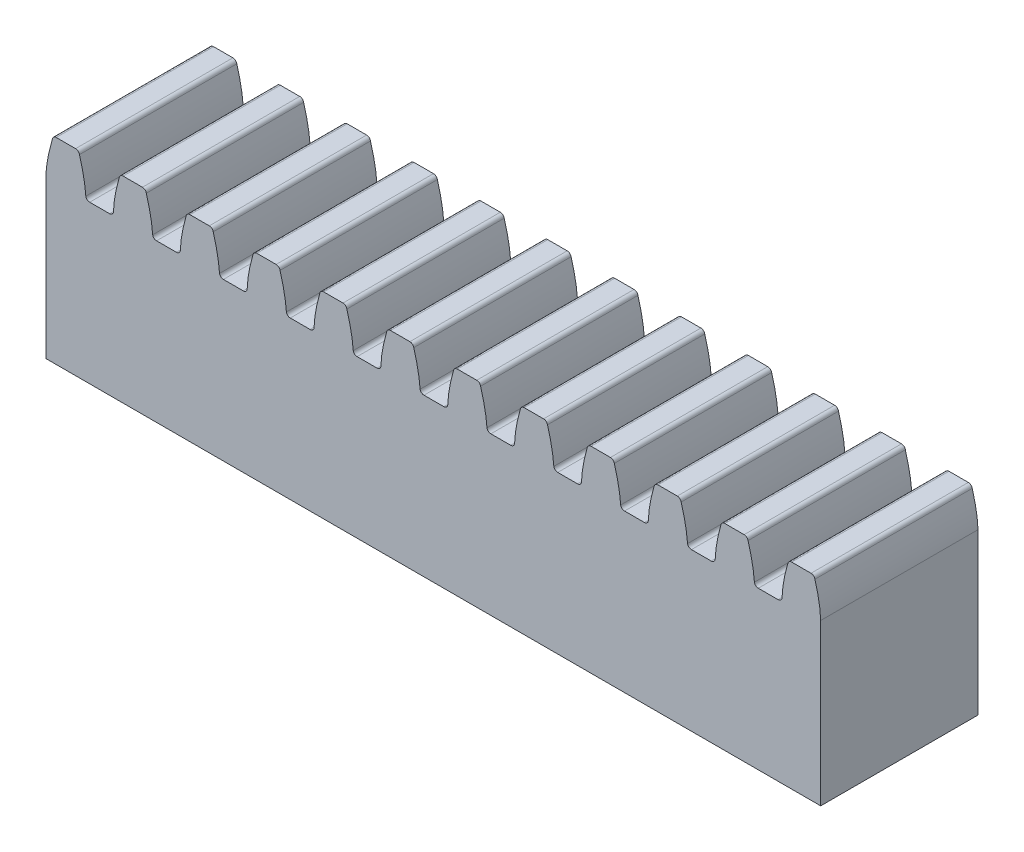
from build123d import *

# Parameters (mm, degrees)
BOSS_EXTRUDE1_DEPTH = 20


with BuildPart() as part:
    # Sketch2 → Boss-Extrude1 (new body)
    with BuildSketch(Plane.XY):
        with BuildLine():
            Line((5.555673684, 0), (8.080450184, 0))
            ThreePointArc((8.080450184, 0), (8.401843989, 0.116977778), (8.572854061, 0.413175911))
            add(Edge.make_bspline(
                [(9.308780843, 4.586824089), (8.63696399, 2.286518146), (8.572854061, 0.413175911)],
                knots=[0, 0, 0, 1, 1, 1], degree=2))
            ThreePointArc((9.308780843, 4.586824089), (9.479790914, 4.883022222), (9.801184719, 5))
            Line((9.801184719, 5), (12.262085088, 5))
            ThreePointArc((12.262085088, 5), (12.583478893, 4.883022222), (12.754488964, 4.586824089))
            add(Edge.make_bspline(
                [(12.754488964, 4.586824089), (13.426305818, 2.286518146), (13.563269807, 0.413175911)],
                knots=[0, 0, 0, 1, 1, 1], degree=2))
            ThreePointArc((13.563269807, 0.413175911), (13.734279879, 0.116977778), (14.055673684, 0))
            Line((14.055673684, 0), (16.580450184, 0))
            ThreePointArc((16.580450184, 0), (16.901843989, 0.116977778), (17.072854061, 0.413175911))
            add(Edge.make_bspline(
                [(17.808780843, 4.586824089), (17.13696399, 2.286518146), (17.072854061, 0.413175911)],
                knots=[0, 0, 0, 1, 1, 1], degree=2))
            ThreePointArc((17.808780843, 4.586824089), (17.979790914, 4.883022222), (18.301184719, 5))
            Line((18.301184719, 5), (20.762085088, 5))
            ThreePointArc((20.762085088, 5), (21.083478893, 4.883022222), (21.254488964, 4.586824089))
            add(Edge.make_bspline(
                [(21.254488964, 4.586824089), (21.926305818, 2.286518146), (22.063269807, 0.413175911)],
                knots=[0, 0, 0, 1, 1, 1], degree=2))
            ThreePointArc((22.063269807, 0.413175911), (22.234279879, 0.116977778), (22.555673684, 0))
            Line((22.555673684, 0), (25.080450184, 0))
            ThreePointArc((25.080450184, 0), (25.401843989, 0.116977778), (25.572854061, 0.413175911))
            add(Edge.make_bspline(
                [(26.308780843, 4.586824089), (25.63696399, 2.286518146), (25.572854061, 0.413175911)],
                knots=[0, 0, 0, 1, 1, 1], degree=2))
            ThreePointArc((26.308780843, 4.586824089), (26.479790914, 4.883022222), (26.801184719, 5))
            Line((26.801184719, 5), (29.262085088, 5))
            ThreePointArc((29.262085088, 5), (29.583478893, 4.883022222), (29.754488964, 4.586824089))
            add(Edge.make_bspline(
                [(29.754488964, 4.586824089), (30.426305818, 2.286518146), (30.563269807, 0.413175911)],
                knots=[0, 0, 0, 1, 1, 1], degree=2))
            ThreePointArc((30.563269807, 0.413175911), (30.734279879, 0.116977778), (31.055673684, 0))
            Line((31.055673684, 0), (33.580450184, 0))
            ThreePointArc((33.580450184, 0), (33.901843989, 0.116977778), (34.072854061, 0.413175911))
            add(Edge.make_bspline(
                [(34.808780843, 4.586824089), (34.13696399, 2.286518146), (34.072854061, 0.413175911)],
                knots=[0, 0, 0, 1, 1, 1], degree=2))
            ThreePointArc((34.808780843, 4.586824089), (34.979790914, 4.883022222), (35.301184719, 5))
            Line((35.301184719, 5), (37.762085088, 5))
            ThreePointArc((37.762085088, 5), (38.083478893, 4.883022222), (38.254488964, 4.586824089))
            add(Edge.make_bspline(
                [(38.254488964, 4.586824089), (38.926305818, 2.286518146), (39.063269807, 0.413175911)],
                knots=[0, 0, 0, 1, 1, 1], degree=2))
            ThreePointArc((39.063269807, 0.413175911), (39.234279879, 0.116977778), (39.555673684, 0))
            Line((39.555673684, 0), (42.080450184, 0))
            ThreePointArc((42.080450184, 0), (42.401843989, 0.116977778), (42.572854061, 0.413175911))
            add(Edge.make_bspline(
                [(43.308780843, 4.586824089), (42.63696399, 2.286518146), (42.572854061, 0.413175911)],
                knots=[0, 0, 0, 1, 1, 1], degree=2))
            ThreePointArc((43.308780843, 4.586824089), (43.479790914, 4.883022222), (43.801184719, 5))
            Line((43.801184719, 5), (46.262085088, 5))
            ThreePointArc((46.262085088, 5), (46.583478893, 4.883022222), (46.754488964, 4.586824089))
            add(Edge.make_bspline(
                [(46.754488964, 4.586824089), (47.426305818, 2.286518146), (47.563269807, 0.413175911)],
                knots=[0, 0, 0, 1, 1, 1], degree=2))
            ThreePointArc((47.563269807, 0.413175911), (47.734279879, 0.116977778), (48.055673684, 0))
            Line((48.055673684, 0), (50.580450184, 0))
            ThreePointArc((50.580450184, 0), (50.901843989, 0.116977778), (51.072854061, 0.413175911))
            add(Edge.make_bspline(
                [(51.808780843, 4.586824089), (51.13696399, 2.286518146), (51.072854061, 0.413175911)],
                knots=[0, 0, 0, 1, 1, 1], degree=2))
            ThreePointArc((51.808780843, 4.586824089), (51.979790914, 4.883022222), (52.301184719, 5))
            Line((52.301184719, 5), (54.762085088, 5))
            ThreePointArc((54.762085088, 5), (55.083478893, 4.883022222), (55.254488964, 4.586824089))
            add(Edge.make_bspline(
                [(55.254488964, 4.586824089), (55.926305818, 2.286518146), (56.063269807, 0.413175911)],
                knots=[0, 0, 0, 1, 1, 1], degree=2))
            ThreePointArc((56.063269807, 0.413175911), (56.234279879, 0.116977778), (56.555673684, 0))
            Line((56.555673684, 0), (59.080450184, 0))
            ThreePointArc((59.080450184, 0), (59.401843989, 0.116977778), (59.572854061, 0.413175911))
            add(Edge.make_bspline(
                [(60.308780843, 4.586824089), (59.63696399, 2.286518146), (59.572854061, 0.413175911)],
                knots=[0, 0, 0, 1, 1, 1], degree=2))
            ThreePointArc((60.308780843, 4.586824089), (60.479790914, 4.883022222), (60.801184719, 5))
            Line((60.801184719, 5), (63.262085088, 5))
            ThreePointArc((63.262085088, 5), (63.583478893, 4.883022222), (63.754488964, 4.586824089))
            add(Edge.make_bspline(
                [(63.754488964, 4.586824089), (64.426305818, 2.286518146), (64.563269807, 0.413175911)],
                knots=[0, 0, 0, 1, 1, 1], degree=2))
            ThreePointArc((64.563269807, 0.413175911), (64.734279879, 0.116977778), (65.055673684, 0))
            Line((65.055673684, 0), (67.580450184, 0))
            ThreePointArc((67.580450184, 0), (67.901843989, 0.116977778), (68.072854061, 0.413175911))
            add(Edge.make_bspline(
                [(68.808780843, 4.586824089), (68.13696399, 2.286518146), (68.072854061, 0.413175911)],
                knots=[0, 0, 0, 1, 1, 1], degree=2))
            ThreePointArc((68.808780843, 4.586824089), (68.979790914, 4.883022222), (69.301184719, 5))
            Line((69.301184719, 5), (71.762085088, 5))
            ThreePointArc((71.762085088, 5), (72.083478893, 4.883022222), (72.254488964, 4.586824089))
            add(Edge.make_bspline(
                [(72.254488964, 4.586824089), (72.926305818, 2.286518146), (73.063269807, 0.413175911)],
                knots=[0, 0, 0, 1, 1, 1], degree=2))
            ThreePointArc((73.063269807, 0.413175911), (73.234279879, 0.116977778), (73.555673684, 0))
            Line((73.555673684, 0), (76.080450184, 0))
            ThreePointArc((76.080450184, 0), (76.401843989, 0.116977778), (76.572854061, 0.413175911))
            add(Edge.make_bspline(
                [(77.308780843, 4.586824089), (76.63696399, 2.286518146), (76.572854061, 0.413175911)],
                knots=[0, 0, 0, 1, 1, 1], degree=2))
            ThreePointArc((77.308780843, 4.586824089), (77.479790914, 4.883022222), (77.801184719, 5))
            Line((77.801184719, 5), (80.262085088, 5))
            ThreePointArc((80.262085088, 5), (80.583478893, 4.883022222), (80.754488964, 4.586824089))
            add(Edge.make_bspline(
                [(80.754488964, 4.586824089), (81.426305818, 2.286518146), (81.563269807, 0.413175911)],
                knots=[0, 0, 0, 1, 1, 1], degree=2))
            ThreePointArc((81.563269807, 0.413175911), (81.734279879, 0.116977778), (82.055673684, 0))
            Line((82.055673684, 0), (84.580450184, 0))
            ThreePointArc((84.580450184, 0), (84.901843989, 0.116977778), (85.072854061, 0.413175911))
            add(Edge.make_bspline(
                [(85.808780843, 4.586824089), (85.13696399, 2.286518146), (85.072854061, 0.413175911)],
                knots=[0, 0, 0, 1, 1, 1], degree=2))
            ThreePointArc((85.808780843, 4.586824089), (85.979790914, 4.883022222), (86.301184719, 5))
            Line((86.301184719, 5), (88.762085088, 5))
            ThreePointArc((88.762085088, 5), (89.083478893, 4.883022222), (89.254488964, 4.586824089))
            add(Edge.make_bspline(
                [(89.254488964, 4.586824089), (89.926305818, 2.286518146), (90.063269807, 0.413175911)],
                knots=[0, 0, 0, 1, 1, 1], degree=2))
            ThreePointArc((90.063269807, 0.413175911), (90.234279879, 0.116977778), (90.555673684, 0))
            Line((90.555673684, 0), (93.080450184, 0))
            ThreePointArc((93.080450184, 0), (93.401843989, 0.116977778), (93.572854061, 0.413175911))
            add(Edge.make_bspline(
                [(94.308780843, 4.586824089), (93.63696399, 2.286518146), (93.572854061, 0.413175911)],
                knots=[0, 0, 0, 1, 1, 1], degree=2))
            ThreePointArc((94.308780843, 4.586824089), (94.479790914, 4.883022222), (94.801184719, 5))
            Line((94.801184719, 5), (97.262085088, 5))
            ThreePointArc((97.262085088, 5), (97.583478893, 4.883022222), (97.754488964, 4.586824089))
            add(Edge.make_bspline(
                [(97.754488964, 4.586824089), (98.426305818, 2.286518146), (98.490415746, 0.413175911)],
                knots=[0, 0, 0, 1, 1, 1], degree=2))
            Line((98.490415746, 0.413175911), (98.490415746, -20))
            Line((98.490415746, -20), (0, -20))
            Line((0, -20), (0, 0))
            Line((0, 0), (0, 0.413175911))
            add(Edge.make_bspline(
                [(0.808780843, 4.586824089), (0.13696399, 2.286518146), (0, 0.413175911)],
                knots=[0, 0, 0, 1, 1, 1], degree=2))
            ThreePointArc((0.808780843, 4.586824089), (0.979790914, 4.883022222), (1.301184719, 5))
            Line((1.301184719, 5), (3.762085088, 5))
            ThreePointArc((3.762085088, 5), (4.083478893, 4.883022222), (4.254488964, 4.586824089))
            add(Edge.make_bspline(
                [(4.254488964, 4.586824089), (4.926305818, 2.286518146), (5.063269807, 0.413175911)],
                knots=[0, 0, 0, 1, 1, 1], degree=2))
            ThreePointArc((5.063269807, 0.413175911), (5.234279879, 0.116977778), (5.555673684, 0))
        make_face()
    extrude(amount=BOSS_EXTRUDE1_DEPTH)


solid = part.part
